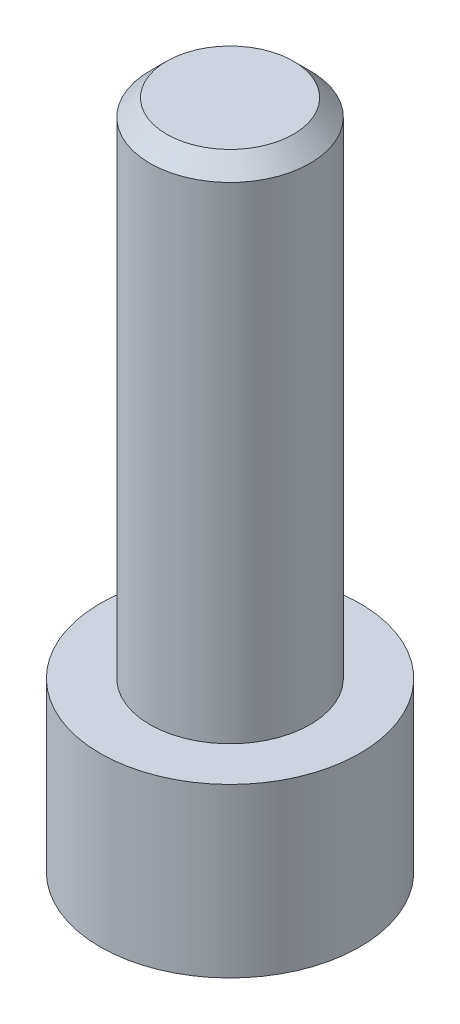
from build123d import *

# Parameters (mm, degrees)
SKETCH1_R           = 3.875
BOSS_EXTRUDE1_DEPTH = 20
SKETCH2_OUTSIDE_W   = 14.312
SKETCH2_OUTSIDE_H   = 14.312
SKETCH2_OUTSIDE_R   = 2.39
CUT_EXTRUDE1_DEPTH  = 15
CHAMFER1_SIZE       = 0.5
CUT_EXTRUDE2_DEPTH  = 3.36


with BuildPart() as part:
    # Sketch1 → Boss-Extrude1 (new body)
    with BuildSketch(Plane(origin=(0, 0, 0), x_dir=(1, 0, 0), z_dir=(0, 1, 0))):
        Circle(SKETCH1_R)
    extrude(amount=BOSS_EXTRUDE1_DEPTH)

    # Sketch2 outside → Cut-Extrude1 (cut)
    with BuildSketch(Plane(origin=(0, 20, 0), x_dir=(1, 0, 0), z_dir=(0, 1, 0))):
        Rectangle(SKETCH2_OUTSIDE_W, SKETCH2_OUTSIDE_H)
        Circle(SKETCH2_OUTSIDE_R, mode=Mode.SUBTRACT)
    extrude(amount=-CUT_EXTRUDE1_DEPTH, mode=Mode.SUBTRACT)

    # Chamfer1
    chamfer1_edges = [part.edges().sort_by_distance(p)[0] for p in [
        (-2.39, 20, 0),
    ]]
    chamfer(chamfer1_edges, length=CHAMFER1_SIZE)

    # Sketch8 → Cut-Extrude2 (cut)
    with BuildSketch(Plane.XZ):
        Polygon((2.644264233, 0), (1.322132116, 2.29), (-1.322132116, 2.29), (-2.644264233, 0), (-1.322132116, -2.29), (1.322132116, -2.29), align=None)
    extrude(amount=-CUT_EXTRUDE2_DEPTH, mode=Mode.SUBTRACT)


solid = part.part
